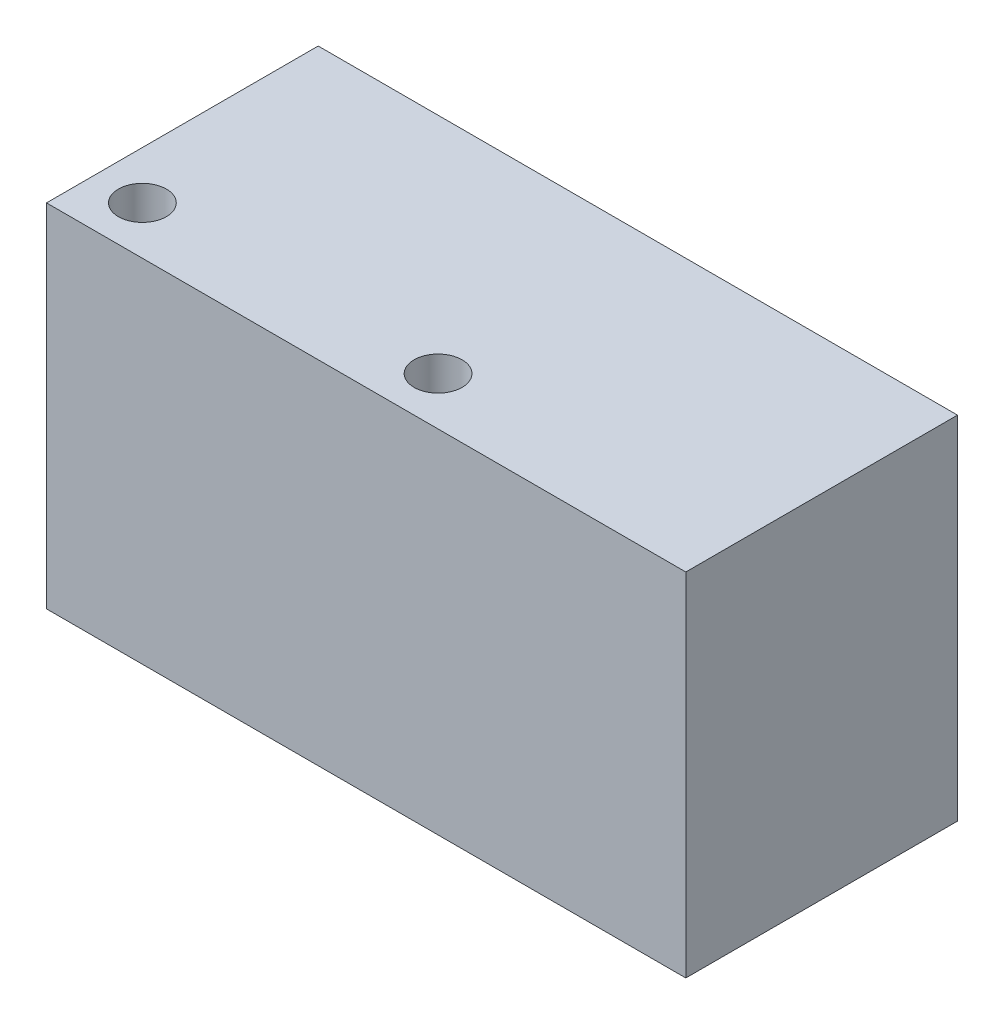
from build123d import *

# Parameters (mm, degrees)
SKETCH1_W           = 40
SKETCH1_H           = 17
BOSS_EXTRUDE1_DEPTH = 22
SKETCH2_R           = 1.5
CUT_EXTRUDE1_DEPTH  = 22
SKETCH3_R           = 1.5
CUT_EXTRUDE2_DEPTH  = 22


with BuildPart() as part:
    # Sketch1 → Boss-Extrude1 (new body)
    with BuildSketch(Plane(origin=(0, 0, 0), x_dir=(1, 0, 0), z_dir=(0, 1, 0))):
        Rectangle(SKETCH1_W, SKETCH1_H)
    extrude(amount=BOSS_EXTRUDE1_DEPTH)

    # Sketch2 → Cut-Extrude1 (cut)
    with BuildSketch(Plane(origin=(0, 22, 0), x_dir=(1, 0, 0), z_dir=(0, 1, 0))):
        with Locations(Location((-17, -5.5, 0), (0, 0, 270))):
            Circle(SKETCH2_R)
    extrude(amount=-CUT_EXTRUDE1_DEPTH, mode=Mode.SUBTRACT)

    # Sketch3 → Cut-Extrude2 (cut)
    with BuildSketch(Plane(origin=(0, 22, 0), x_dir=(1, 0, 0), z_dir=(0, 1, 0))):
        with Locations(Location((1.5, -5.5, 0), (0, 0, 270))):
            Circle(SKETCH3_R)
    extrude(amount=-CUT_EXTRUDE2_DEPTH, mode=Mode.SUBTRACT)


solid = part.part
